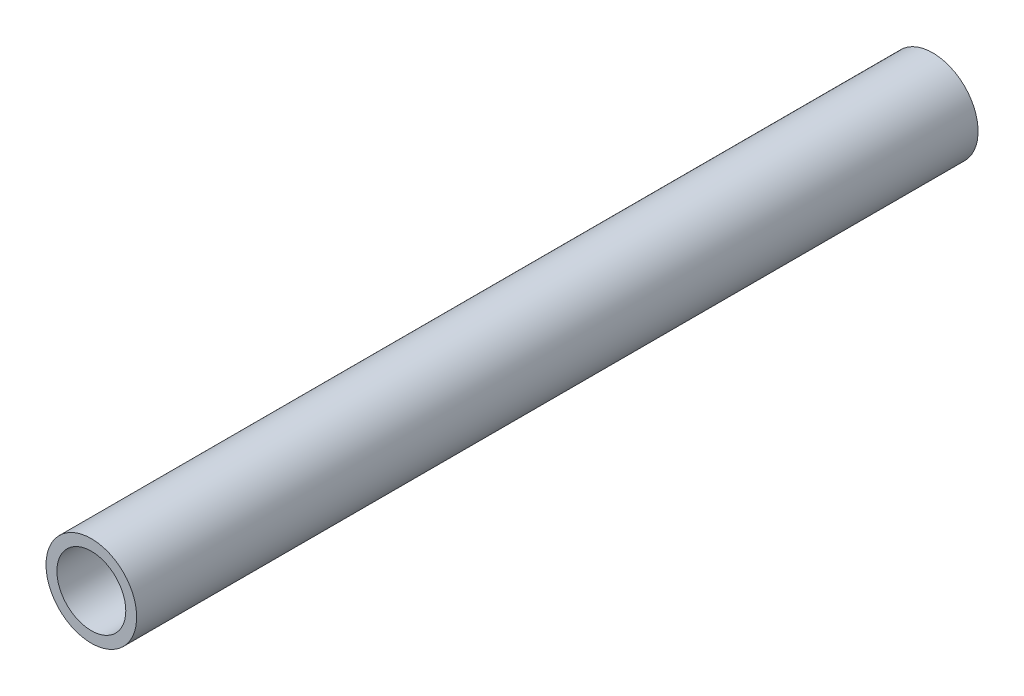
from build123d import *

# Parameters (mm, degrees)
SKETCH1_R           = 12.5
BOSS_EXTRUDE1_DEPTH = 232
SKETCH2_R           = 9.5
CUT_EXTRUDE1_DEPTH  = 252


with BuildPart() as part:
    # Sketch1 → Boss-Extrude1 (new body)
    with BuildSketch(Plane.XY.offset(230)):
        with Locations(Location((300, 300, 0), (0, 0, 180))):
            Circle(SKETCH1_R)
    extrude(amount=BOSS_EXTRUDE1_DEPTH)

    # Sketch2 → Cut-Extrude1 (cut)
    with BuildSketch(Plane.XY.offset(462)):
        with Locations((300, 300)):
            Circle(SKETCH2_R)
    extrude(amount=-CUT_EXTRUDE1_DEPTH, mode=Mode.SUBTRACT)


solid = part.part
